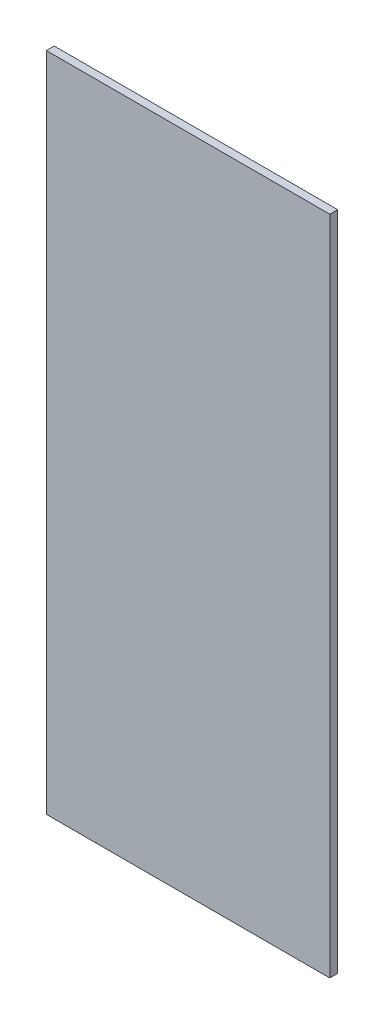
from build123d import *

# Parameters (mm, degrees)
ESQUISSE1_W        = 180
ESQUISSE1_H        = 420
BOSS_EXTRU_1_DEPTH = 5


with BuildPart() as part:
    # Esquisse1 → Boss.-Extru.1 (new body)
    with BuildSketch(Plane.XY):
        Rectangle(ESQUISSE1_W, ESQUISSE1_H)
    extrude(amount=BOSS_EXTRU_1_DEPTH)


solid = part.part
